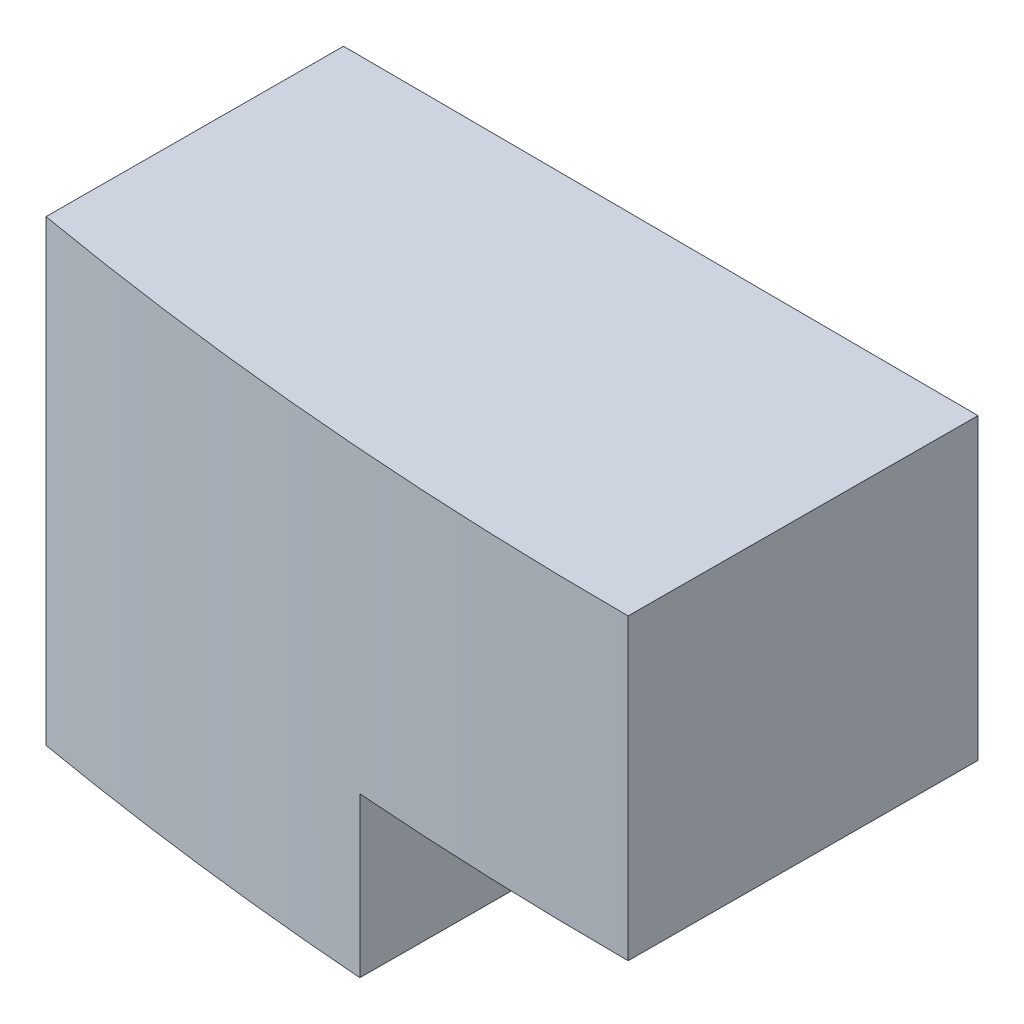
from build123d import *

# Parameters (mm, degrees)
RESSALTO_EXTRUS_O1_DEPTH = 9.2
ESBO_O3_W                = 5.6
ESBO_O3_H                = 3.2
CORTE_EXTRUS_O1_DEPTH    = 18.034534118


with BuildPart() as part:
    # Esboço1 → Ressalto-extrusão1 (new body)
    with BuildSketch(Plane(origin=(0, 0, 0), x_dir=(1, 0, 0), z_dir=(0, 1, 0))):
        with BuildLine():
            Line((0, -75), (0.029321703, -68))
            Line((0.029321703, -68), (-12.770566003, -67.946383642))
            Line((-12.770566003, -67.946383642), (-12.795506441, -73.900439883))
            ThreePointArc((-12.795506441, -73.900439883), (-6.421331979, -74.724604352), (0, -75))
        make_face()
    extrude(amount=RESSALTO_EXTRUS_O1_DEPTH)

    # Esboço3 → Corte-extrusão1 (cut, through all)
    with BuildSketch(Plane(origin=(-0.284833888, 0, 67.99868406), x_dir=(-0.9999912270311377, 0, -0.0041887779553967395), z_dir=(0.0041887779553967395, 0, -0.9999912270311377))):
        with Locations((2.485841653, 1.6)):
            Rectangle(ESBO_O3_W, ESBO_O3_H)
    extrude(amount=-CORTE_EXTRUS_O1_DEPTH, mode=Mode.SUBTRACT)


solid = part.part
